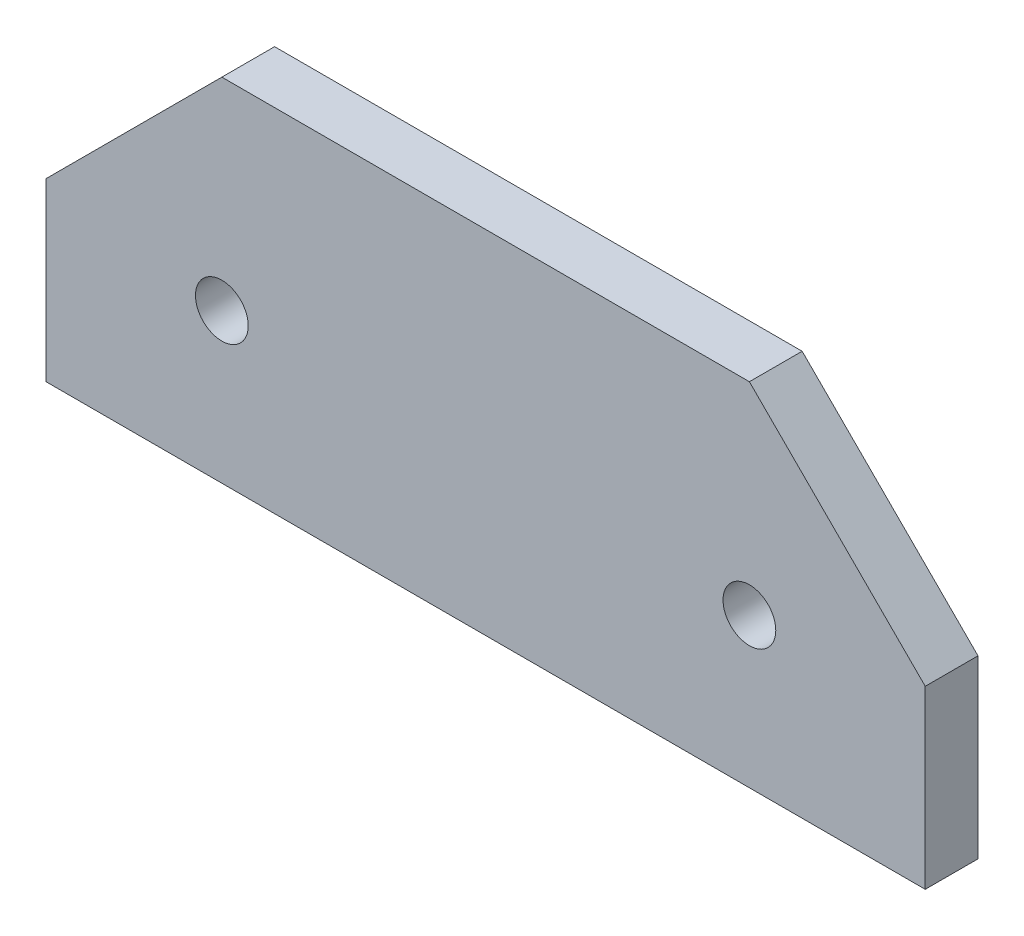
from build123d import *

# Parameters (mm, degrees)
CROQUIS1_R              = 1.5
SALIENTE_EXTRUIR1_DEPTH = 3


with BuildPart() as part:
    # Croquis1 → Saliente-Extruir1 (new body)
    with BuildSketch(Plane.XY):
        Polygon((-25, 0), (-15, 10), (15, 10), (25, 0), (25, -10), (-25, -10), align=None)
        with Locations((-15, -1.5)):
            Circle(CROQUIS1_R, mode=Mode.SUBTRACT)
        with Locations((15, -1.5)):
            Circle(CROQUIS1_R, mode=Mode.SUBTRACT)
    extrude(amount=SALIENTE_EXTRUIR1_DEPTH)


solid = part.part
